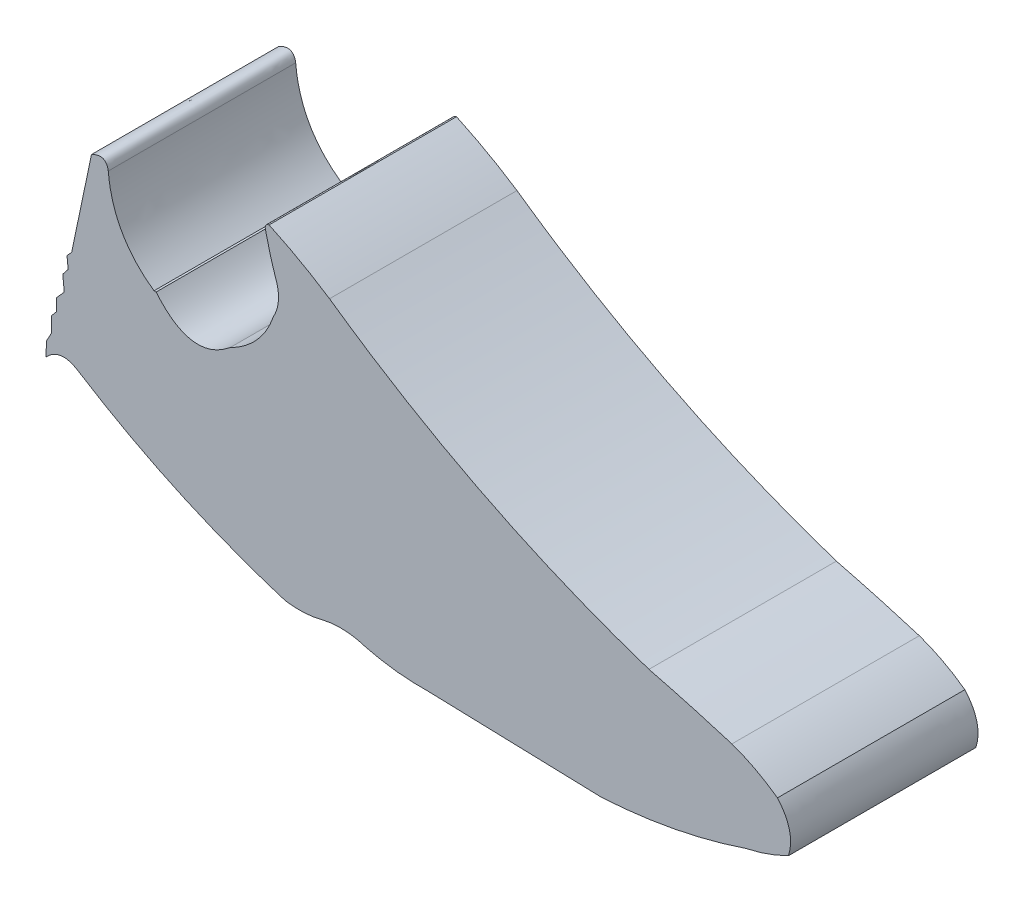
from build123d import *

# Parameters (mm, degrees)
BOSS_EXTRUDE1_DEPTH = 228.6


with BuildPart() as part:
    # Sketch1 → Boss-Extrude1 (new body)
    with BuildSketch(Plane.XY):
        with BuildLine():
            Line((-151.308507478, 320.448347343), (-153.902884159, 320.448347343))
            add(Edge.make_bspline(
                [(-153.902884159, 320.448347343), (-204.193593484, 355.830302978), (-209.681982797, 419.080625746)],
                knots=[0, 0, 0, 1, 1, 1], degree=2))
            add(Edge.make_bspline(
                [(-209.681982797, 419.080625746), (-212.468971889, 435.635081793), (-230.146422985, 426.26627389)],
                knots=[0, 0, 0, 1, 1, 1], degree=2))
            Line((-230.146422985, 426.26627389), (-254.364738426, 310.76353871))
            Line((-254.364738426, 310.76353871), (-260.02419987, 304.566542475))
            Line((-260.02419987, 304.566542475), (-258.578921486, 290.691869988))
            Line((-258.578921486, 290.691869988), (-265.193093483, 282.384698892))
            Line((-265.193093483, 282.384698892), (-263.369961518, 264.24078968))
            Line((-263.369961518, 264.24078968), (-272.846204191, 253.680341164))
            Line((-272.846204191, 253.680341164), (-273.030336503, 238.665049502))
            Line((-273.030336503, 238.665049502), (-279.067580784, 231.420751471))
            Line((-279.067580784, 231.420751471), (-278.892342657, 213.438930008))
            Line((-278.892342657, 213.438930008), (-285.037056209, 201.886868531))
            Line((-285.037056209, 201.886868531), (-285.631103618, 184.685583339))
            add(Edge.make_bspline(
                [(-285.631103618, 184.685583339), (-268.062935634, 203.22280378), (-246.614344295, 189.659725427)],
                knots=[0, 0, 0, 1, 1, 1], degree=2))
            add(Edge.make_bspline(
                [(-246.614344295, 189.659725427), (-127.920705679, 114.429612695), (6.673773744, 73.083350339)],
                knots=[0, 0, 0, 1, 1, 1], degree=2))
            add(Edge.make_bspline(
                [(6.673773744, 73.083350339), (28.666663993, 69.758079655), (50.443660227, 75.311339463)],
                knots=[0, 0, 0, 1, 1, 1], degree=2))
            add(Edge.make_bspline(
                [(50.443660227, 75.311339463), (77.641446166, 82.046433693), (104.763627465, 73.083350339)],
                knots=[0, 0, 0, 1, 1, 1], degree=2))
            add(Edge.make_bspline(
                [(104.763627465, 73.083350339), (141.460227891, 63.748172731), (179.63636286, 64.622561677)],
                knots=[0, 0, 0, 1, 1, 1], degree=2))
            Line((179.63636286, 64.622561677), (392.082197073, 58.29218063))
            add(Edge.make_bspline(
                [(392.082197073, 58.29218063), (482.5670898, 63.486005848), (568.127479803, 92.380936595)],
                knots=[0, 0, 0, 1, 1, 1], degree=2))
            add(Edge.make_bspline(
                [(568.127479803, 92.380936595), (595.430658845, 98.233924977), (619.963244193, 110.663717217)],
                knots=[0, 0, 0, 1, 1, 1], degree=2))
            add(Edge.make_bspline(
                [(619.963244193, 110.663717217), (629.007847964, 139.298696012), (606.486634537, 165.008668656)],
                knots=[0, 0, 0, 1, 1, 1], degree=2))
            add(Edge.make_bspline(
                [(606.486634537, 165.008668656), (580.79478885, 183.685281275), (550.927071991, 194.234435924)],
                knots=[0, 0, 0, 1, 1, 1], degree=2))
            add(Edge.make_bspline(
                [(550.927071991, 194.234435924), (500.725829633, 209.711245508), (449.760265594, 222.422706898)],
                knots=[0, 0, 0, 1, 1, 1], degree=2))
            add(Edge.make_bspline(
                [(449.760265594, 222.422706898), (241.262282516, 291.708486768), (60.192619276, 419.080625746)],
                knots=[0, 0, 0, 1, 1, 1], degree=2))
            add(Edge.make_bspline(
                [(60.192619276, 419.080625746), (24.832715259, 442.475671603), (-13.561949274, 460.190317475)],
                knots=[0, 0, 0, 1, 1, 1], degree=2))
            add(Edge.make_bspline(
                [(-13.561949274, 460.190317475), (-19.66491685, 459.046402337), (-17.821966678, 452.380802052)],
                knots=[0, 0, 0, 1, 1, 1], degree=2))
            add(Edge.make_bspline(
                [(-17.821966678, 452.380802052), (-12.318595056, 427.744919978), (-4.138222221, 403.861238748)],
                knots=[0, 0, 0, 1, 1, 1], degree=2))
            add(Edge.make_bspline(
                [(-4.138222221, 403.861238748), (1.674072586, 384.699876217), (-8.164307919, 366.08094882)],
                knots=[0, 0, 0, 1, 1, 1], degree=2))
            add(Edge.make_bspline(
                [(-8.164307919, 366.08094882), (-21.973615339, 326.401145795), (-61.04518825, 306.862929248)],
                knots=[0, 0, 0, 1, 1, 1], degree=2))
            add(Edge.make_bspline(
                [(-61.04518825, 306.862929248), (-108.230426593, 268.595120107), (-151.308507478, 320.448347343)],
                knots=[0, 0, 0, 1, 1, 1], degree=2))
        make_face()
    extrude(amount=BOSS_EXTRUDE1_DEPTH)


solid = part.part
